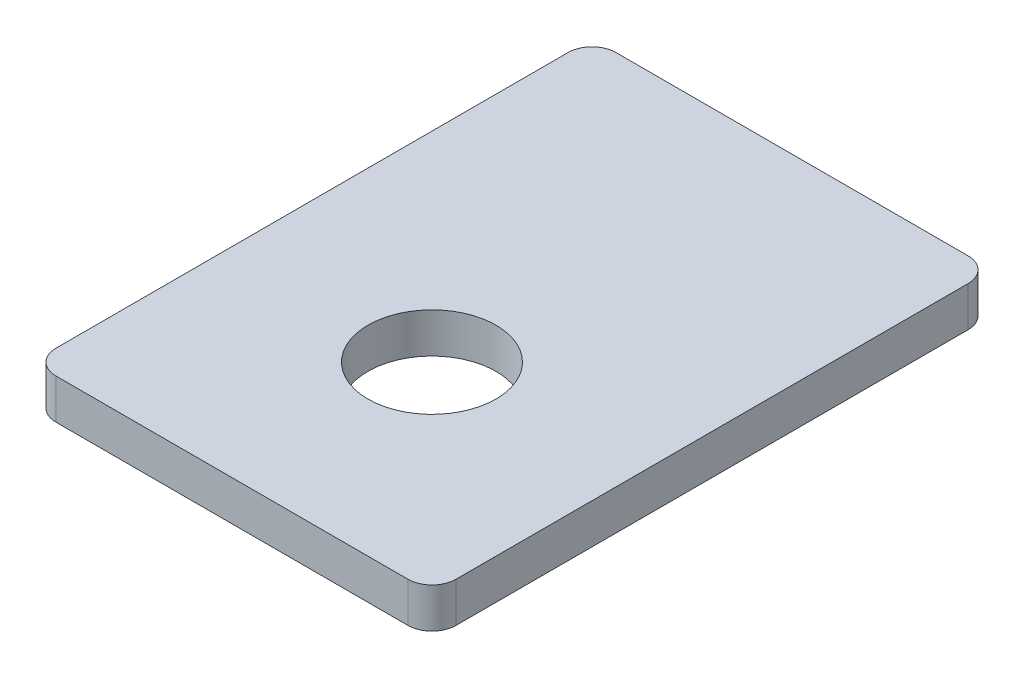
from build123d import *

# Parameters (mm, degrees)
SKETCH_1_W             = 50
SKETCH_1_H             = 5
BLOCKEXTRUDE_DEPTH     = 70
FILLET_2_R             = 3
SKETCH_2_R             = 8
ROTARY_SEAL_SEAT_DEPTH = 87.168439698


with BuildPart() as part:
    # 草图1 → BlockExtrude (new body)
    with BuildSketch(Plane.XY):
        with Locations((25, 2.5)):
            Rectangle(SKETCH_1_W, SKETCH_1_H)
    extrude(amount=BLOCKEXTRUDE_DEPTH)

    # Fillet 2
    fillet_2_edges = [part.edges().sort_by_distance(p)[0] for p in [
        (50, 2.5, 70),
        (0, 2.5, 70),
        (50, 2.5, 0),
        (0, 2.5, 0),
    ]]
    fillet(fillet_2_edges, radius=FILLET_2_R)

    # 草图2 → Rotary_seal_seat (cut, through all)
    with BuildSketch(Plane(origin=(0, 5, 0), x_dir=(1, 0, 0), z_dir=(0, 1, 0))):
        with Locations(Location((25, -45, 0), (0, 0, 270))):
            Circle(SKETCH_2_R)
    extrude(amount=-ROTARY_SEAL_SEAT_DEPTH, mode=Mode.SUBTRACT)


solid = part.part
